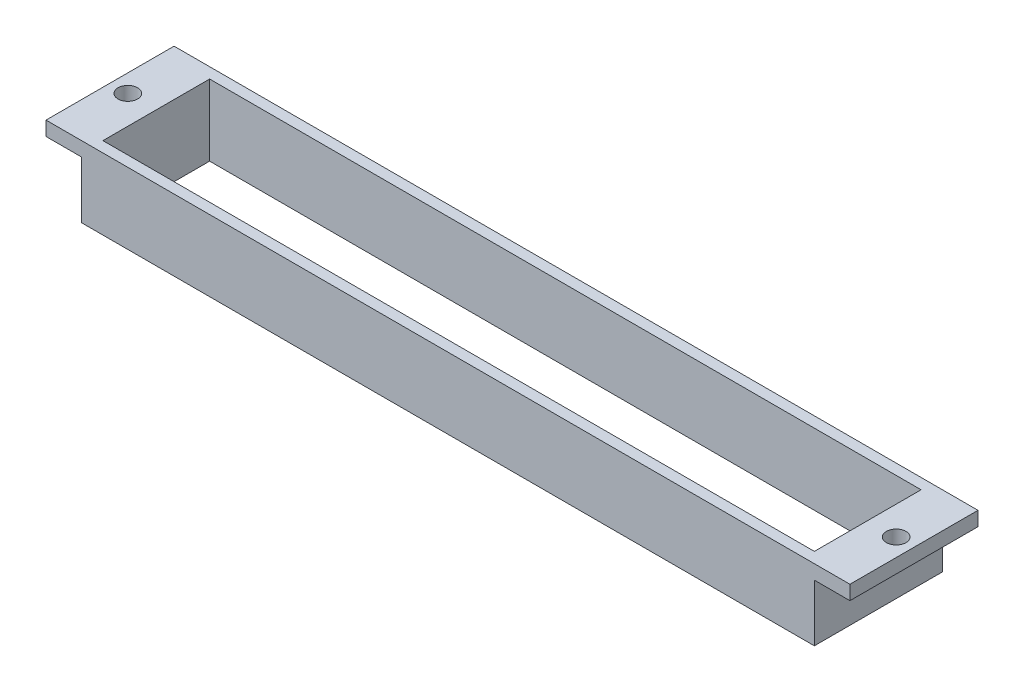
from build123d import *

# Parameters (mm, degrees)
SKETCH_1_W          = 206
SKETCH_1_H          = 36
SKETCH_1_W_2        = 200
SKETCH_1_H_2        = 30
EXTRUDE_1_DEPTH     = 20
SKETCH_2_W          = 10
SKETCH_2_H          = 36
EXTRUDE_2_DEPTH     = 4
SKETCH_3_R          = 2.75
CUT_EXTRUDE_1_DEPTH = 4


with BuildPart() as part:
    # 草图1 → 凸台-拉伸1 (new body)
    with BuildSketch(Plane(origin=(0, 0, 0), x_dir=(1, 0, 0), z_dir=(0, 1, 0))):
        Rectangle(SKETCH_1_W, SKETCH_1_H)
        Rectangle(SKETCH_1_W_2, SKETCH_1_H_2, mode=Mode.SUBTRACT)
    extrude(amount=EXTRUDE_1_DEPTH)

    # 草图2 → 凸台-拉伸2 (add)
    with BuildSketch(Plane(origin=(0, 20, 0), x_dir=(1, 0, 0), z_dir=(0, 1, 0))):
        with Locations((-108, 0)):
            Rectangle(SKETCH_2_W, SKETCH_2_H)
        with Locations((108, 0)):
            Rectangle(SKETCH_2_W, SKETCH_2_H)
    extrude(amount=-EXTRUDE_2_DEPTH)

    # 草图3 → 切除-拉伸1 (cut)
    with BuildSketch(Plane(origin=(0, 20, 0), x_dir=(1, 0, 0), z_dir=(0, 1, 0))):
        with Locations(Location((108, 0, 0), (0, 0, 270))):
            Circle(SKETCH_3_R)
        with Locations(Location((-108, 0, 0), (0, 0, 270))):
            Circle(SKETCH_3_R)
    extrude(amount=-CUT_EXTRUDE_1_DEPTH, mode=Mode.SUBTRACT)


solid = part.part
